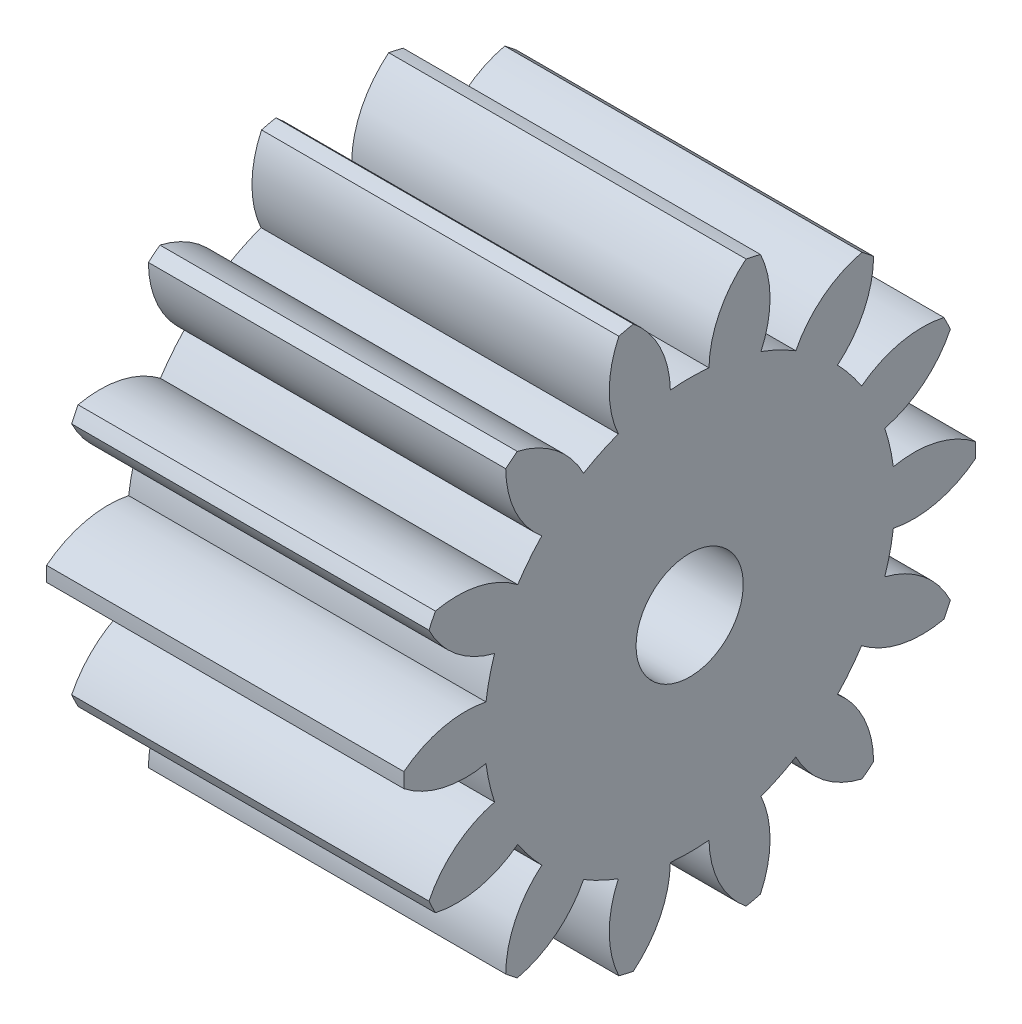
from build123d import *

# Parameters (mm, degrees)
BASPROSKE_W        = 10
BASPROSKE_H        = 8
TOOTHCUT_DEPTH     = 16.099668871
TEETHCUTS_COUNT    = 14
TEETHCUTS_ANGLE    = 334.285714286
BORSKE_R           = 1.5
BORE_DEPTH         = 50.0000508
CUT_EXTRUDE1_DEPTH = 4


with BuildPart() as part:
    # BasProSke → Base-Revolve (revolve)
    with BuildSketch(Plane(origin=(0, 0, 0), x_dir=(1, 0, 0), z_dir=(0, 1, 0)), mode=Mode.PRIVATE) as base_revolve_sk:
        with Locations((5, 4)):
            Rectangle(BASPROSKE_W, BASPROSKE_H)
    revolve(base_revolve_sk.sketch.rotate(Axis((-10, 0, 0), (1, 0, 0)), 180), axis=Axis((-10, 0, 0), (1, 0, 0)))

    # TooCutSke → ToothCut (cut, through all)
    with BuildSketch(Plane(origin=(0, 0, 0), x_dir=(0, 0, -1), z_dir=(1, 0, 0))):
        with BuildLine():
            ThreePointArc((0.540393256, 5.723545765), (0, 5.749), (-0.540393256, 5.723545765))
            ThreePointArc((-0.540393256, 5.723545765), (-0.832220085, 6.912663993), (-1.603550271, 7.863566092))
            ThreePointArc((-1.603550271, 7.863566092), (0, 8.0254), (1.603550271, 7.863566092))
            ThreePointArc((1.603550271, 7.863566092), (0.832220085, 6.912663993), (0.540393256, 5.723545765))
        make_face()
    toothcut = extrude(amount=TOOTHCUT_DEPTH, mode=Mode.SUBTRACT)

    # TeethCuts: ToothCut ×14 about axis
    teethcuts_axis = Axis((-10, 0, 0), (1, 0, 0))
    for i in range(1, TEETHCUTS_COUNT):
        add(toothcut.rotate(teethcuts_axis, i * TEETHCUTS_ANGLE / (TEETHCUTS_COUNT - 1)), mode=Mode.SUBTRACT)

    # BorSke → Bore (cut, symmetric)
    with BuildSketch(Plane(origin=(0, 0, 0), x_dir=(0, 0, -1), z_dir=(1, 0, 0))):
        with Locations(Location((0, 0, 0), (0, 0, 180))):
            Circle(BORSKE_R)
    extrude(amount=BORE_DEPTH, both=True, mode=Mode.SUBTRACT)

    # Sketch1 → Cut-Extrude1 (cut)
    with BuildSketch(Plane.ZY):
        Polygon((0.37552517, 2.972587809), (0, 2.7), (-0.37552517, 2.972587809), (-0.671462695, 2.615174535), (-1.102979883, 2.785809184), (-1.30073492, 2.366028036), (-1.761130314, 2.423987923), (-1.848277186, 1.968215294), (-2.308622449, 1.909858586), (-2.279685399, 1.446732346), (-2.711055346, 1.27572581), (-2.567852594, 0.834345885), (-2.943142665, 0.56143449), (-2.694672167, 0.169534403), (-2.990301506, -0.188133824), (-2.652175577, -0.505929549), (-2.849568706, -0.925880998), (-2.443033042, -1.149604087), (-2.529787024, -1.605451664), (-2.080385755, -1.721044772), (-2.05104952, -2.184145897), (-1.587020181, -2.184345885), (-1.44343703, -2.625602211), (-0.993936292, -2.510396512), (-0.745128084, -2.902082282), (-0.338399731, -2.678709694), (0, -2.99621385), (0.338399731, -2.678709694), (0.745128084, -2.902082282), (0.993936292, -2.510396512), (1.44343703, -2.625602211), (1.587020181, -2.184345885), (2.05104952, -2.184145897), (2.080385755, -1.721044772), (2.529787024, -1.605451664), (2.443033042, -1.149604087), (2.849568706, -0.925880998), (2.652175577, -0.505929549), (2.990301506, -0.188133824), (2.694672167, 0.169534403), (2.943142665, 0.56143449), (2.567852594, 0.834345885), (2.711055346, 1.27572581), (2.279685399, 1.446732346), (2.308622449, 1.909858586), (1.848277186, 1.968215294), (1.761130314, 2.423987923), (1.30073492, 2.366028036), (1.102979883, 2.785809184), (0.671462695, 2.615174535), align=None)
    extrude(amount=-CUT_EXTRUDE1_DEPTH, mode=Mode.SUBTRACT)


solid = part.part
